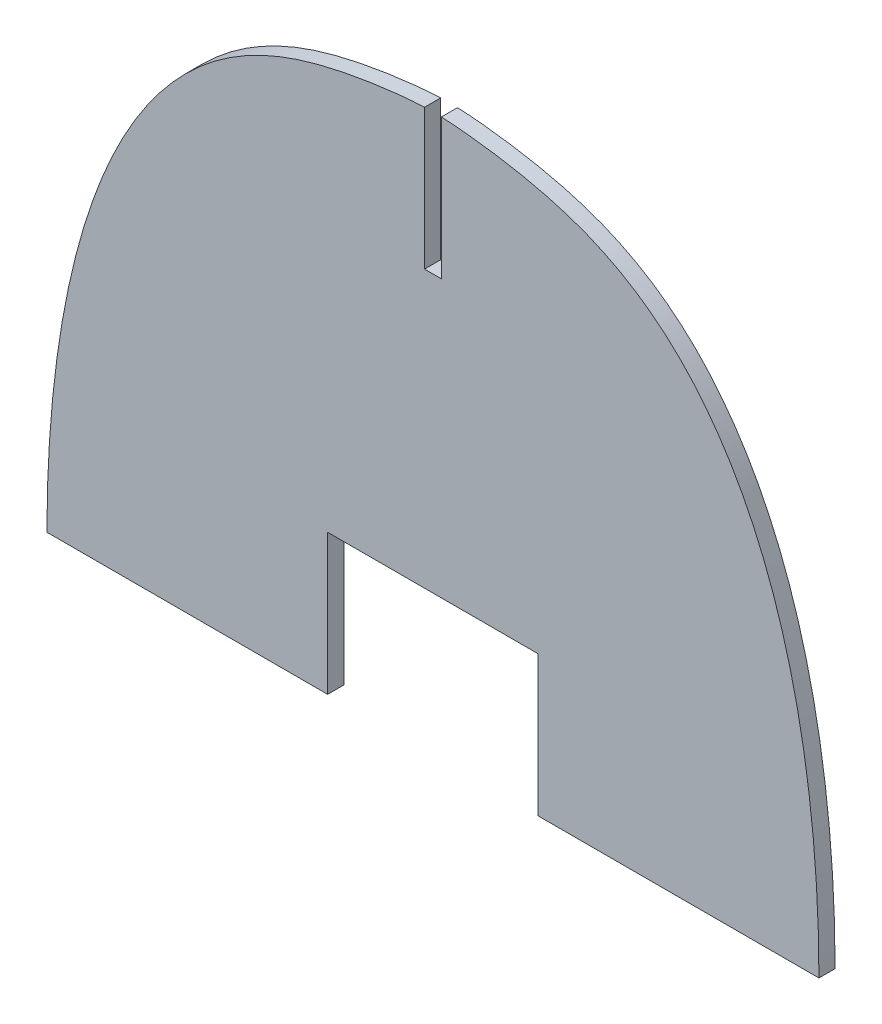
from build123d import *

# Parameters (mm, degrees)
BOSS_EXTRUDE1_DEPTH = 5.842
SKETCH3_W           = 38.1
SKETCH3_H           = 50.8
SKETCH3_W_2         = 3.048
CUT_EXTRUDE1_DEPTH  = 279.88332514


with BuildPart() as part:
    # Sketch2 → Boss-Extrude1 (new body)
    with BuildSketch(Plane.XY):
        with BuildLine():
            Line((139.7, 39.6875), (0, 39.6875))
            Line((0, 39.6875), (0, 241.3))
            add(Edge.make_bspline(
                [(0, 241.3), (9.008186532, 241.3), (56.656890408, 236.359137648), (128.782940081, 181.905443126), (139.7, 89.922843118), (139.7, 39.6875)],
                knots=[0, 0, 0, 0, 0.176272275, 0.390301895, 1, 1, 1, 1], degree=3))
        make_face()
    extrude(amount=BOSS_EXTRUDE1_DEPTH)

    # Sketch3 → Cut-Extrude1 (cut, through all)
    with BuildSketch(Plane.XY.offset(5.842)):
        with Locations((19.05, 65.0875)):
            Rectangle(SKETCH3_W, SKETCH3_H)
        with Locations((1.524, 215.9)):
            Rectangle(SKETCH3_W_2, SKETCH3_H)
    extrude(amount=-CUT_EXTRUDE1_DEPTH, mode=Mode.SUBTRACT)

    # Mirror1: part across plane


with BuildPart() as part_1:
    add(part.part)
    add(part.part.mirror(Plane(origin=(0, 0, 0), x_dir=(0, 0, 1), z_dir=(1, 0, 0))))


solid = part_1.part
